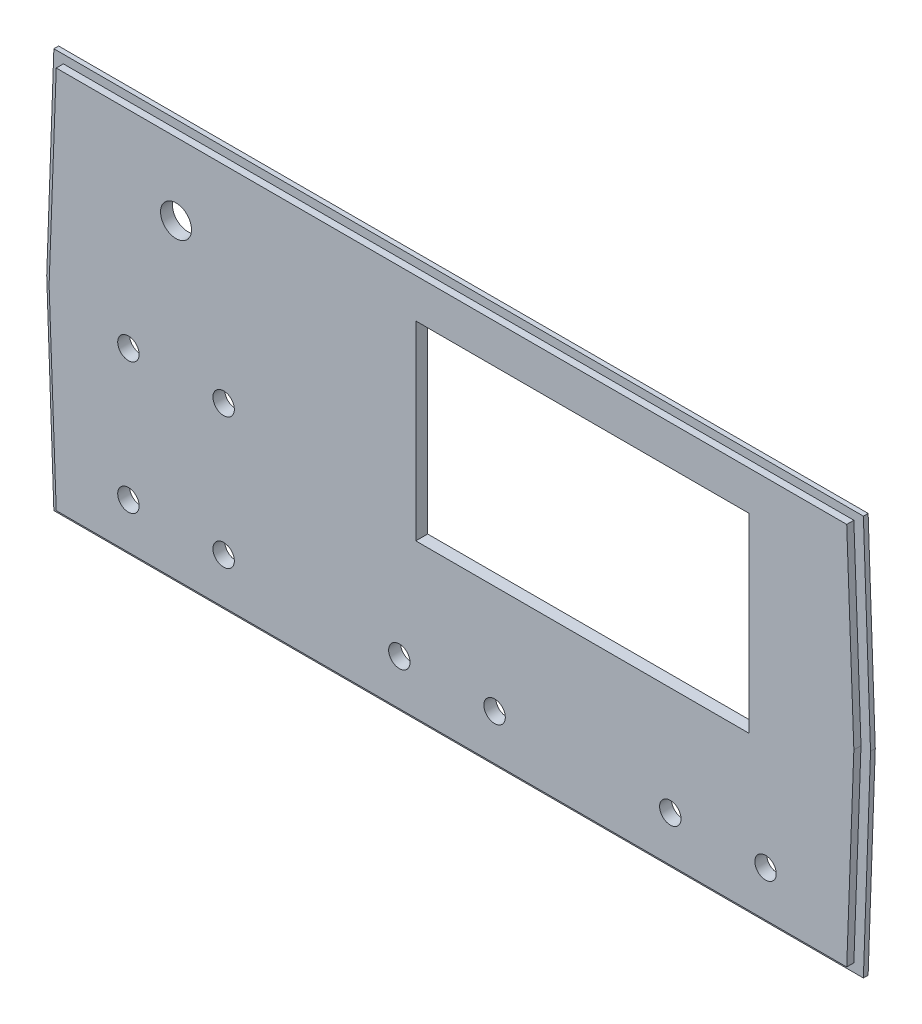
from build123d import *

# Parameters (mm, degrees)
BOSS_EXTRUDE1_DEPTH = 1
BOSS_EXTRUDE2_DEPTH = 1.5
SKETCH3_W           = 70
SKETCH3_H           = 40
CUT_EXTRUDE1_DEPTH  = 10
SKETCH4_R           = 2.25
SKETCH4_R_2         = 3.25
CUT_EXTRUDE3_DEPTH  = 10


with BuildPart() as part:
    # Sketch1 → Boss-Extrude1 (new body)
    with BuildSketch(Plane.XY):
        Polygon((-85, 42), (85, 42), (86.5, 0), (85, -42), (-85, -42), (-86.5, 0), align=None)
    extrude(amount=BOSS_EXTRUDE1_DEPTH)

    # Sketch2 → Boss-Extrude2 (add)
    with BuildSketch(Plane.XY.offset(1)):
        Polygon((-83, 40.25), (83, 40.25), (84.5, 0), (83, -40.25), (-83, -40.25), (-84.5, 0), align=None)
    extrude(amount=BOSS_EXTRUDE2_DEPTH)

    # Sketch3 → Cut-Extrude1 (cut)
    with BuildSketch(Plane(origin=(0, 0, 0), x_dir=(-1, 0, 0), z_dir=(0, 0, -1))):
        with Locations((-27.5, 12)):
            Rectangle(SKETCH3_W, SKETCH3_H)
    extrude(amount=-CUT_EXTRUDE1_DEPTH, mode=Mode.SUBTRACT)

    # Sketch4 → Cut-Extrude3 (cut)
    with BuildSketch(Plane(origin=(0, 0, 0), x_dir=(-1, 0, 0), z_dir=(0, 0, -1))):
        with Locations((-65.954695658, -30.705934388)):
            Circle(SKETCH4_R)
        with Locations((-45.954695658, -30.705934388)):
            Circle(SKETCH4_R)
        with Locations((-9.054695658, -30.705934388)):
            Circle(SKETCH4_R)
        with Locations((10.945304342, -30.705934388)):
            Circle(SKETCH4_R)
        with Locations((47.845022936, -30.705934388)):
            Circle(SKETCH4_R)
        with Locations((67.845022936, -30.705934388)):
            Circle(SKETCH4_R)
        with Locations((67.845022936, -3.141963924)):
            Circle(SKETCH4_R)
        with Locations((47.845022936, -3.141963924)):
            Circle(SKETCH4_R)
        with Locations((57.845022936, 25.044065612)):
            Circle(SKETCH4_R_2)
    extrude(amount=-CUT_EXTRUDE3_DEPTH, mode=Mode.SUBTRACT)


solid = part.part
